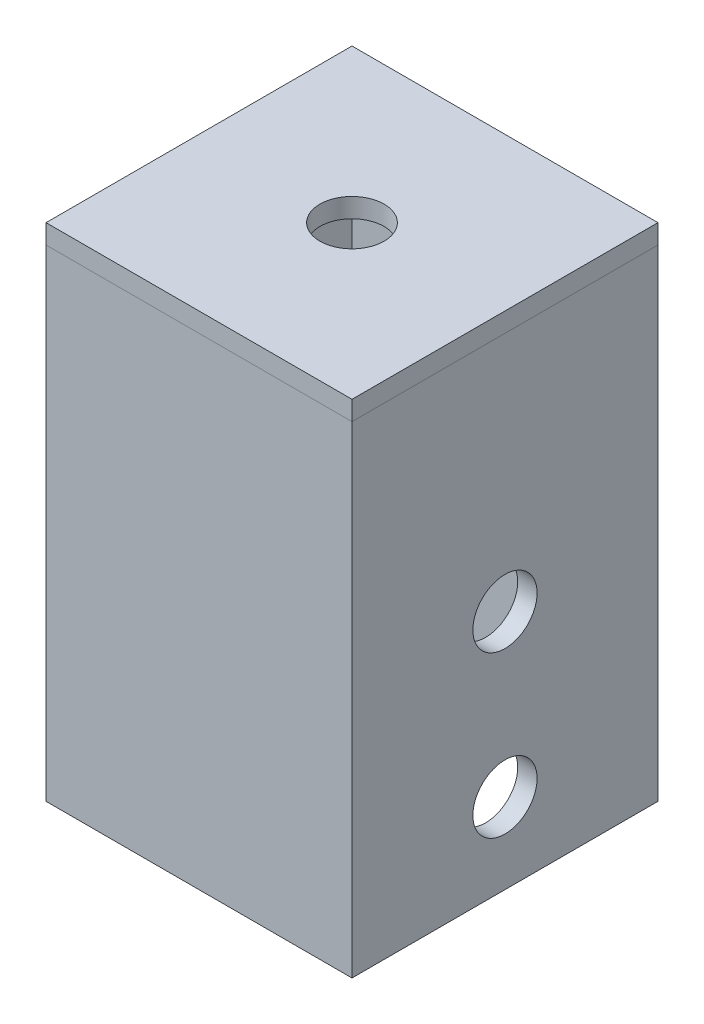
from build123d import *

# Parameters (mm, degrees)
SKETCH1_W                                      = 38.1
SKETCH1_H                                      = 38.1
SKETCH1_W_2                                    = 33.274
SKETCH1_H_2                                    = 33.274
TUBO_CUADRADO_AL_AL_TUBE_1_5_SQR_X_0_095_DEPTH = 60
CROQUIS3_R                                     = 4
CORTAR_EXTRUIR1_DEPTH                          = 74.583371083
TAPA_EN_EXTREMO1_THICKNESS                     = 2.41
CROQUIS5_R                                     = 4
CORTAR_EXTRUIR2_DEPTH                          = 10


with BuildPart() as part:
    # Sketch1 → Tubo cuadrado al AL TUBE 1.5 SQR X 0.095 WALL(1) (new body)
    with BuildSketch(Plane(origin=(0, 0, 0), x_dir=(-1, 0, 0), z_dir=(0, 1, 0))):
        Rectangle(SKETCH1_W, SKETCH1_H)
        Rectangle(SKETCH1_W_2, SKETCH1_H_2, mode=Mode.SUBTRACT)
    extrude(amount=TUBO_CUADRADO_AL_AL_TUBE_1_5_SQR_X_0_095_DEPTH)

    # Croquis3 → Cortar-Extruir1 (cut, through all)
    with BuildSketch(Plane(origin=(19.05, 0, 0), x_dir=(0, 0, -1), z_dir=(1, 0, 0))):
        with Locations((0, 10)):
            Circle(CROQUIS3_R)
        with Locations((0, 30)):
            Circle(CROQUIS3_R)
    extrude(amount=-CORTAR_EXTRUIR1_DEPTH, mode=Mode.SUBTRACT)


with BuildPart() as body_2:
    # Tapa en extremo1: an end cap: a plate 2.41 thick on the member's open end, its outline the end's outer outline
    tapa_en_extremo1_end = part.part.faces().sort_by_distance((18.4785, 60, -18.4785))[0]
    add(extrude(Face(tapa_en_extremo1_end.outer_wire()), amount=TAPA_EN_EXTREMO1_THICKNESS, dir=(0, 1, 0)))

    # Croquis5 → Cortar-Extruir2 (cut)
    with BuildSketch(Plane(origin=(0, 62.41, 0), x_dir=(1, 0, 0), z_dir=(0, 1, 0))):
        with Locations(Location((0, 0, 0), (0, 0, 270))):
            Circle(CROQUIS5_R)
    extrude(amount=-CORTAR_EXTRUIR2_DEPTH, mode=Mode.SUBTRACT)


solid = Compound([part.part, body_2.part])
